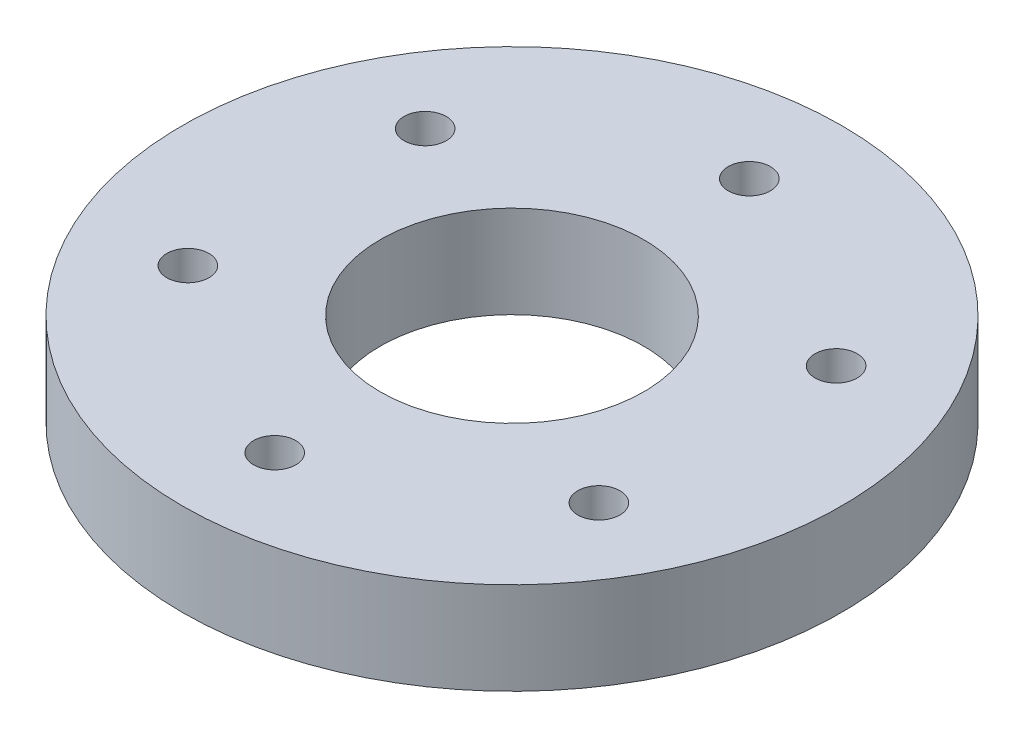
from build123d import *

# Parameters (mm, degrees)
SKETCH1_R             = 3
BOSS_EXTRUDE1_DEPTH   = 10
BOSS_EXTRUDE1_2_DEPTH = 10
BOSS_EXTRUDE1_3_DEPTH = 10
BOSS_EXTRUDE1_4_DEPTH = 10
BOSS_EXTRUDE1_5_DEPTH = 10
BOSS_EXTRUDE1_6_DEPTH = 10
SKETCH2_R             = 25
BOSS_EXTRUDE2_DEPTH   = 7
SKETCH3_R             = 10
CUT_EXTRUDE1_DEPTH    = 40.230090492
SKETCH4_R             = 1.6
CUT_EXTRUDE2_DEPTH    = 10
SKETCH5_W             = 46.619491236
SKETCH5_H             = 46.698911153
CUT_EXTRUDE3_DEPTH    = 10
SKETCH6_R             = 3
CUT_EXTRUDE4_DEPTH    = 2


with BuildPart() as part:
    # Sketch1 → Boss-Extrude1 (new body)
    with BuildSketch(Plane(origin=(0, 0, 0), x_dir=(1, 0, 0), z_dir=(0, 1, 0))):
        with Locations(Location((0, 18, 0), (0, 0, 270))):
            Circle(SKETCH1_R)
    extrude(amount=BOSS_EXTRUDE1_DEPTH)



with BuildPart() as body_2:
    # Sketch1 → Boss-Extrude1 2 (new body)
    with BuildSketch(Plane(origin=(0, 0, 0), x_dir=(1, 0, 0), z_dir=(0, 1, 0))):
        with Locations(Location((15.588457268, 9, 0), (0, 0, 270))):
            Circle(SKETCH1_R)
    extrude(amount=BOSS_EXTRUDE1_2_DEPTH)


with BuildPart() as body_3:
    # Sketch1 → Boss-Extrude1 3 (new body)
    with BuildSketch(Plane(origin=(0, 0, 0), x_dir=(1, 0, 0), z_dir=(0, 1, 0))):
        with Locations(Location((15.588457268, -9, 0), (0, 0, 270))):
            Circle(SKETCH1_R)
    extrude(amount=BOSS_EXTRUDE1_3_DEPTH)


with BuildPart() as body_4:
    # Sketch1 → Boss-Extrude1 4 (new body)
    with BuildSketch(Plane(origin=(0, 0, 0), x_dir=(1, 0, 0), z_dir=(0, 1, 0))):
        with Locations(Location((0, -18, 0), (0, 0, 270))):
            Circle(SKETCH1_R)
    extrude(amount=BOSS_EXTRUDE1_4_DEPTH)


with BuildPart() as body_5:
    # Sketch1 → Boss-Extrude1 5 (new body)
    with BuildSketch(Plane(origin=(0, 0, 0), x_dir=(1, 0, 0), z_dir=(0, 1, 0))):
        with Locations(Location((-15.588457268, -9, 0), (0, 0, 270))):
            Circle(SKETCH1_R)
    extrude(amount=BOSS_EXTRUDE1_5_DEPTH)


with BuildPart() as body_6:
    # Sketch1 → Boss-Extrude1 6 (new body)
    with BuildSketch(Plane(origin=(0, 0, 0), x_dir=(1, 0, 0), z_dir=(0, 1, 0))):
        with Locations(Location((-15.588457268, 9, 0), (0, 0, 270))):
            Circle(SKETCH1_R)
    extrude(amount=BOSS_EXTRUDE1_6_DEPTH)


with BuildPart() as part_1:
    add(part.part)

    add(body_2.part)  # Boss-Extrude2 merges body 2

    add(body_3.part)  # Boss-Extrude2 merges body 3

    add(body_4.part)  # Boss-Extrude2 merges body 4

    add(body_5.part)  # Boss-Extrude2 merges body 5

    add(body_6.part)  # Boss-Extrude2 merges body 6
    # Sketch2 → Boss-Extrude2 (add)
    with BuildSketch(Plane(origin=(0, 10, 0), x_dir=(1, 0, 0), z_dir=(0, 1, 0))):
        with Locations(Location((0, 0, 0), (0, 0, 90))):
            Circle(SKETCH2_R)
    extrude(amount=BOSS_EXTRUDE2_DEPTH)

    # Sketch3 → Cut-Extrude1 (cut, through all)
    with BuildSketch(Plane(origin=(0, 17, 0), x_dir=(1, 0, 0), z_dir=(0, 1, 0))):
        with Locations(Location((0, 0, 0), (0, 0, 270))):
            Circle(SKETCH3_R)
    extrude(amount=-CUT_EXTRUDE1_DEPTH, mode=Mode.SUBTRACT)

    # Sketch4 → Cut-Extrude2 (cut)
    with BuildSketch(Plane(origin=(0, 17, 0), x_dir=(1, 0, 0), z_dir=(0, 1, 0))):
        with Locations(Location((0, 18, 0), (0, 0, 270))):
            Circle(SKETCH4_R)
        with Locations(Location((15.588457268, 9, 0), (0, 0, 270))):
            Circle(SKETCH4_R)
        with Locations(Location((15.588457268, -9, 0), (0, 0, 270))):
            Circle(SKETCH4_R)
        with Locations(Location((0, -18, 0), (0, 0, 270))):
            Circle(SKETCH4_R)
        with Locations(Location((-15.588457268, -9, 0), (0, 0, 270))):
            Circle(SKETCH4_R)
        with Locations(Location((-15.588457268, 9, 0), (0, 0, 270))):
            Circle(SKETCH4_R)
    extrude(amount=-CUT_EXTRUDE2_DEPTH, mode=Mode.SUBTRACT)

    # Sketch5 → Cut-Extrude3 (cut)
    with BuildSketch(Plane.XZ):
        with Locations((3.295926552, -0.079419917)):
            Rectangle(SKETCH5_W, SKETCH5_H)
    extrude(amount=-CUT_EXTRUDE3_DEPTH, mode=Mode.SUBTRACT)

    # Sketch6 → Cut-Extrude4 (cut)
    with BuildSketch(Plane(origin=(0, 10, 0), x_dir=(-1, 0, 0), z_dir=(0, -1, 0))):
        with Locations(Location((0, -18, 0), (0, 0, 90))):
            Circle(SKETCH6_R)
        with Locations(Location((15.588457268, 9, 0), (0, 0, 90))):
            Circle(SKETCH6_R)
        with Locations(Location((-15.588457268, 9, 0), (0, 0, 90))):
            Circle(SKETCH6_R)
    extrude(amount=-CUT_EXTRUDE4_DEPTH, mode=Mode.SUBTRACT)


solid = part_1.part
